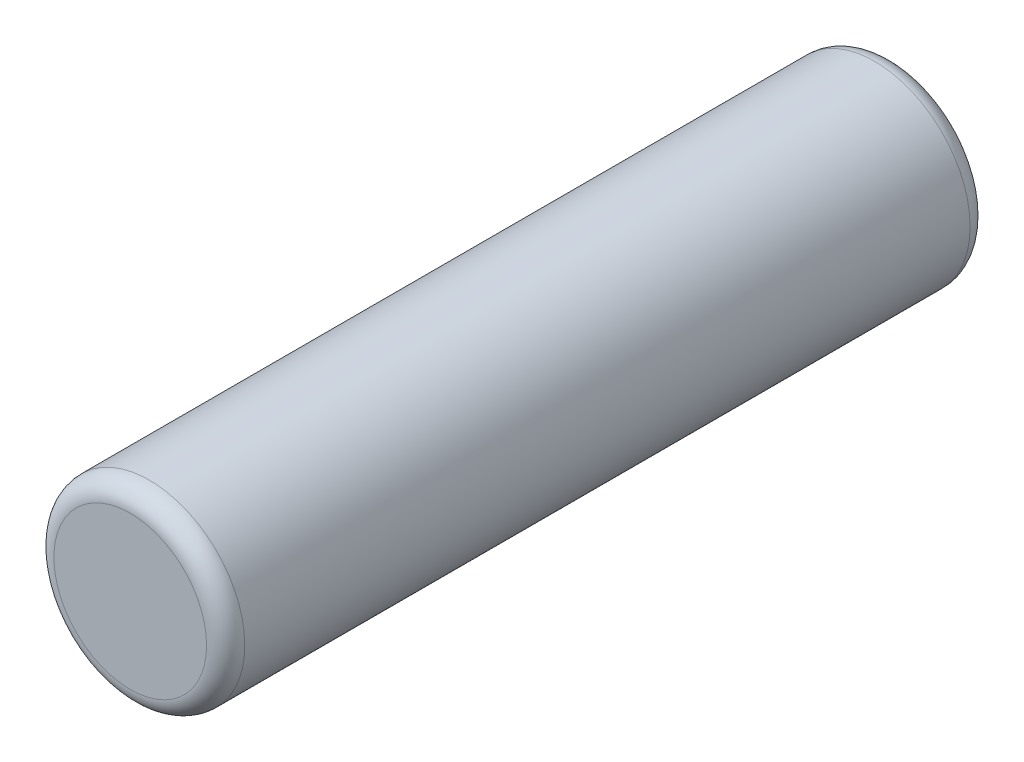
from build123d import *

# Parameters (mm, degrees)
SKETCH2_R           = 2.5
BOSS_EXTRUDE1_DEPTH = 20
FILLET1_R           = 0.5


with BuildPart() as part:
    # Sketch2 → Boss-Extrude1 (new body)
    with BuildSketch(Plane.XY):
        Circle(SKETCH2_R)
    extrude(amount=BOSS_EXTRUDE1_DEPTH)

    # Fillet1
    fillet1_edges = [part.edges().sort_by_distance(p)[0] for p in [
        (-2.5, 0, 0),
        (-2.5, 0, 20),
    ]]
    fillet(fillet1_edges, radius=FILLET1_R)


solid = part.part
